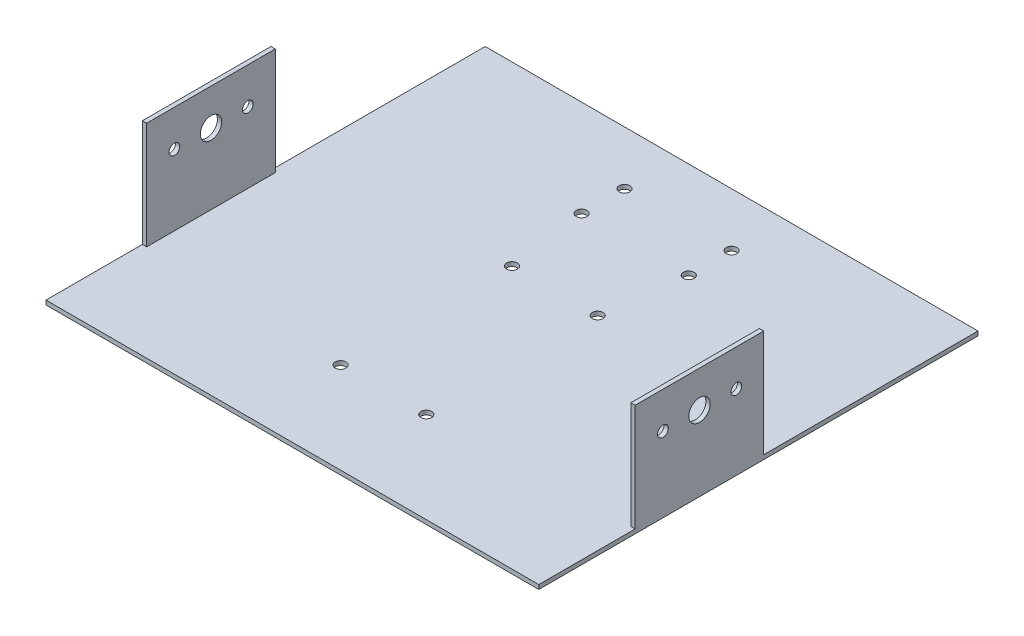
from build123d import *

# Parameters (mm, degrees)
BOSS_EXTRUDE1_DEPTH = 2
SKETCH2_W           = 2
SKETCH2_H           = 60
BOSS_EXTRUDE2_DEPTH = 50
SKETCH6_R           = 2.5
CUT_EXTRUDE3_DEPTH  = 20
SKETCH8_R           = 2.5
CUT_EXTRUDE5_DEPTH  = 10
SKETCH9_W           = 230
SKETCH9_H           = 50
BOSS_EXTRUDE3_DEPTH = 2
SKETCH10_R          = 2.5
CUT_EXTRUDE6_DEPTH  = 16
SKETCH12_R          = 5
CUT_EXTRUDE7_DEPTH  = 242
SKETCH15_R          = 2.5
CUT_EXTRUDE8_DEPTH  = 242


with BuildPart() as part:
    # Sketch1 → Boss-Extrude1 (new body)
    with BuildSketch(Plane(origin=(0, 0, 0), x_dir=(1, 0, 0), z_dir=(0, 1, 0))):
        Polygon((115, 50), (115, 80), (-115, 80), (-115, 50), (-115, -50), (-115, -75), (115, -75), (115, -50), align=None)
    extrude(amount=BOSS_EXTRUDE1_DEPTH)

    # Sketch2 → Boss-Extrude2 (add)
    with BuildSketch(Plane(origin=(0, 2, 0), x_dir=(1, 0, 0), z_dir=(0, 1, 0))):
        with Locations((-114, 0)):
            Rectangle(SKETCH2_W, SKETCH2_H)
        with Locations((114, 0)):
            Rectangle(SKETCH2_W, SKETCH2_H)
    extrude(amount=BOSS_EXTRUDE2_DEPTH)

    # Sketch6 → Cut-Extrude3 (cut)
    with BuildSketch(Plane(origin=(0, 2, 0), x_dir=(1, 0, 0), z_dir=(0, 1, 0))):
        with Locations(Location((-20, 47.5, 0), (0, 0, 270))):
            Circle(SKETCH6_R)
        with Locations(Location((20, 47.5, 0), (0, 0, 270))):
            Circle(SKETCH6_R)
    extrude(amount=-CUT_EXTRUDE3_DEPTH, mode=Mode.SUBTRACT)

    # Sketch8 → Cut-Extrude5 (cut)
    with BuildSketch(Plane(origin=(0, 2, 0), x_dir=(1, 0, 0), z_dir=(0, 1, 0))):
        with Locations(Location((-20, -32.5, 0), (0, 0, 270))):
            Circle(SKETCH8_R)
        with Locations(Location((20, -32.5, 0), (0, 0, 270))):
            Circle(SKETCH8_R)
    extrude(amount=-CUT_EXTRUDE5_DEPTH, mode=Mode.SUBTRACT)

    # Sketch9 → Boss-Extrude3 (add)
    with BuildSketch(Plane(origin=(0, 2, 0), x_dir=(1, 0, 0), z_dir=(0, 1, 0))):
        with Locations((0, 105)):
            Rectangle(SKETCH9_W, SKETCH9_H)
    extrude(amount=-BOSS_EXTRUDE3_DEPTH)

    # Sketch10 → Cut-Extrude6 (cut)
    with BuildSketch(Plane(origin=(0, 2, 0), x_dir=(1, 0, 0), z_dir=(0, 1, 0))):
        with Locations(Location((-25, 85, 0), (0, 0, 270))):
            Circle(SKETCH10_R)
        with Locations(Location((-25, 105, 0), (0, 0, 270))):
            Circle(SKETCH10_R)
        with Locations(Location((25, 105, 0), (0, 0, 90))):
            Circle(SKETCH10_R)
        with Locations(Location((25, 85, 0), (0, 0, 90))):
            Circle(SKETCH10_R)
    extrude(amount=-CUT_EXTRUDE6_DEPTH, mode=Mode.SUBTRACT)

    # Sketch12 → Cut-Extrude7 (cut)
    with BuildSketch(Plane.ZY.offset(115)):
        with Locations((0, 35.05138551)):
            Circle(SKETCH12_R)
    extrude(amount=-CUT_EXTRUDE7_DEPTH, mode=Mode.SUBTRACT)

    # Sketch15 → Cut-Extrude8 (cut)
    with BuildSketch(Plane.ZY.offset(115)):
        with Locations((-17.223737456, 35)):
            Circle(SKETCH15_R)
        with Locations((17.063876513, 35)):
            Circle(SKETCH15_R)
    extrude(amount=-CUT_EXTRUDE8_DEPTH, mode=Mode.SUBTRACT)


solid = part.part
